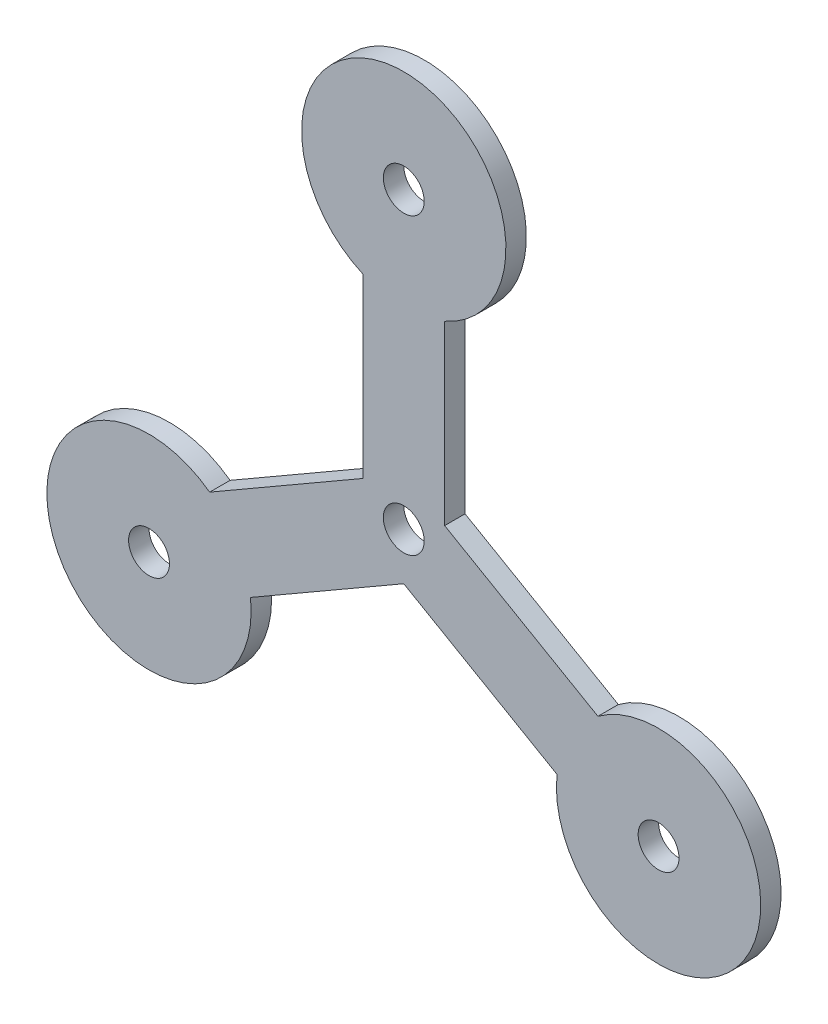
from build123d import *

# Parameters (mm, degrees)
BOSS_EXTRUDE2_DEPTH = 10
SKETCH3_R           = 50
BOSS_EXTRUDE3_DEPTH = 10
SKETCH4_R           = 10
BOSS_EXTRUDE4_DEPTH = 90
CUT_EXTRUDE1_START  = -30
SKETCH5_R           = 10
CUT_EXTRUDE1_DEPTH  = 30
SKETCH6_R           = 13
CUT_EXTRUDE2_DEPTH  = 10
SKETCH7_R           = 10
BOSS_EXTRUDE5_DEPTH = 30
SKETCH8_R           = 20.369169003
BOSS_EXTRUDE6_DEPTH = 10
CUT_EXTRUDE3_START  = -100
SKETCH9_R           = 10
CUT_EXTRUDE3_DEPTH  = 100
SKETCH10_R          = 10
CUT_EXTRUDE4_DEPTH  = 10


with BuildPart() as part:
    # Sketch1 → Boss-Extrude2 (new body)
    with BuildSketch(Plane.XY):
        Polygon((20, 144), (-20, 144), (-20, 11.547005384), (-134.707658145, -54.679491924), (-114.707658145, -89.320508076), (0, -23.094010768), (114.707658145, -89.320508076), (134.707658145, -54.679491924), (20, 11.547005384), align=None)
    extrude(amount=BOSS_EXTRUDE2_DEPTH)

    # Sketch3 → Boss-Extrude3 (add)
    with BuildSketch(Plane.XY.offset(10)):
        with Locations((-124.707658145, -72)):
            Circle(SKETCH3_R)
        with Locations((0, 144)):
            Circle(SKETCH3_R)
        with Locations((124.707658145, -72)):
            Circle(SKETCH3_R)
    extrude(amount=-BOSS_EXTRUDE3_DEPTH)

    # Sketch4 → Boss-Extrude4 (add)
    with BuildSketch(Plane.XY.offset(10)):
        with Locations(Location((0, 144, 0), (0, 0, 180))):
            Circle(SKETCH4_R)
        with Locations(Location((124.707658145, -72, 0), (0, 0, 180))):
            Circle(SKETCH4_R)
        with Locations(Location((-124.707658145, -72, 0), (0, 0, 180))):
            Circle(SKETCH4_R)
    extrude(amount=BOSS_EXTRUDE4_DEPTH)

    # Sketch5 → Cut-Extrude1 (cut)
    with BuildSketch(Plane.XY.offset(100).offset(CUT_EXTRUDE1_START)):
        with Locations(Location((0, 144, 0), (0, 0, 180))):
            Circle(SKETCH5_R)
    extrude(amount=CUT_EXTRUDE1_DEPTH, mode=Mode.SUBTRACT)

    # Sketch6 → Cut-Extrude2 (cut)
    with BuildSketch(Plane.XY.offset(10)):
        Circle(SKETCH6_R)
    extrude(amount=-CUT_EXTRUDE2_DEPTH, mode=Mode.SUBTRACT)

    # Sketch7 → Boss-Extrude5 (add)
    with BuildSketch(Plane.XY.offset(70)):
        with Locations(Location((0, 144, 0), (0, 0, 180))):
            Circle(SKETCH7_R)
    extrude(amount=BOSS_EXTRUDE5_DEPTH)

    # Sketch8 → Boss-Extrude6 (add)
    with BuildSketch(Plane.XY.offset(10)):
        Circle(SKETCH8_R)
    extrude(amount=-BOSS_EXTRUDE6_DEPTH)

    # Sketch9 → Cut-Extrude3 (cut)
    with BuildSketch(Plane.XY.offset(100).offset(CUT_EXTRUDE3_START)):
        with Locations((-124.707658145, -72)):
            Circle(SKETCH9_R)
        with Locations((0, 144)):
            Circle(SKETCH9_R)
        with Locations((124.707658145, -72)):
            Circle(SKETCH9_R)
    extrude(amount=CUT_EXTRUDE3_DEPTH, mode=Mode.SUBTRACT)

    # Sketch10 → Cut-Extrude4 (cut)
    with BuildSketch(Plane.XY.offset(10)):
        Circle(SKETCH10_R)
    extrude(amount=-CUT_EXTRUDE4_DEPTH, mode=Mode.SUBTRACT)


solid = part.part
